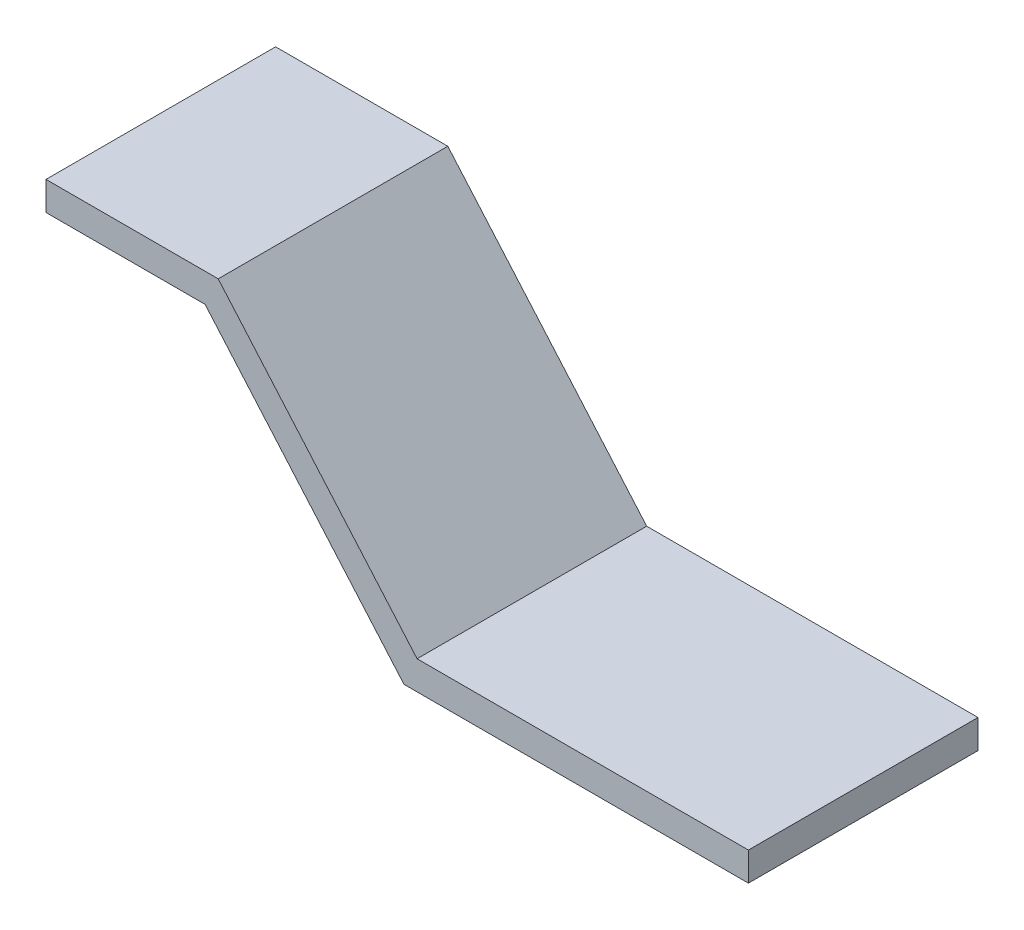
from build123d import *

# Parameters (mm, degrees)
BOSS_EXTRUDE2_DEPTH = 200


with BuildPart() as part:
    # Sketch2 → Boss-Extrude2 (new body)
    with BuildSketch(Plane.XY):
        Polygon((0, 0), (150, 0), (323.221924627, -200), (611.801395417, -200), (611.801395417, -225), (311.801395417, -225), (138.579470789, -25), (0, -25), align=None)
    extrude(amount=BOSS_EXTRUDE2_DEPTH)


solid = part.part
